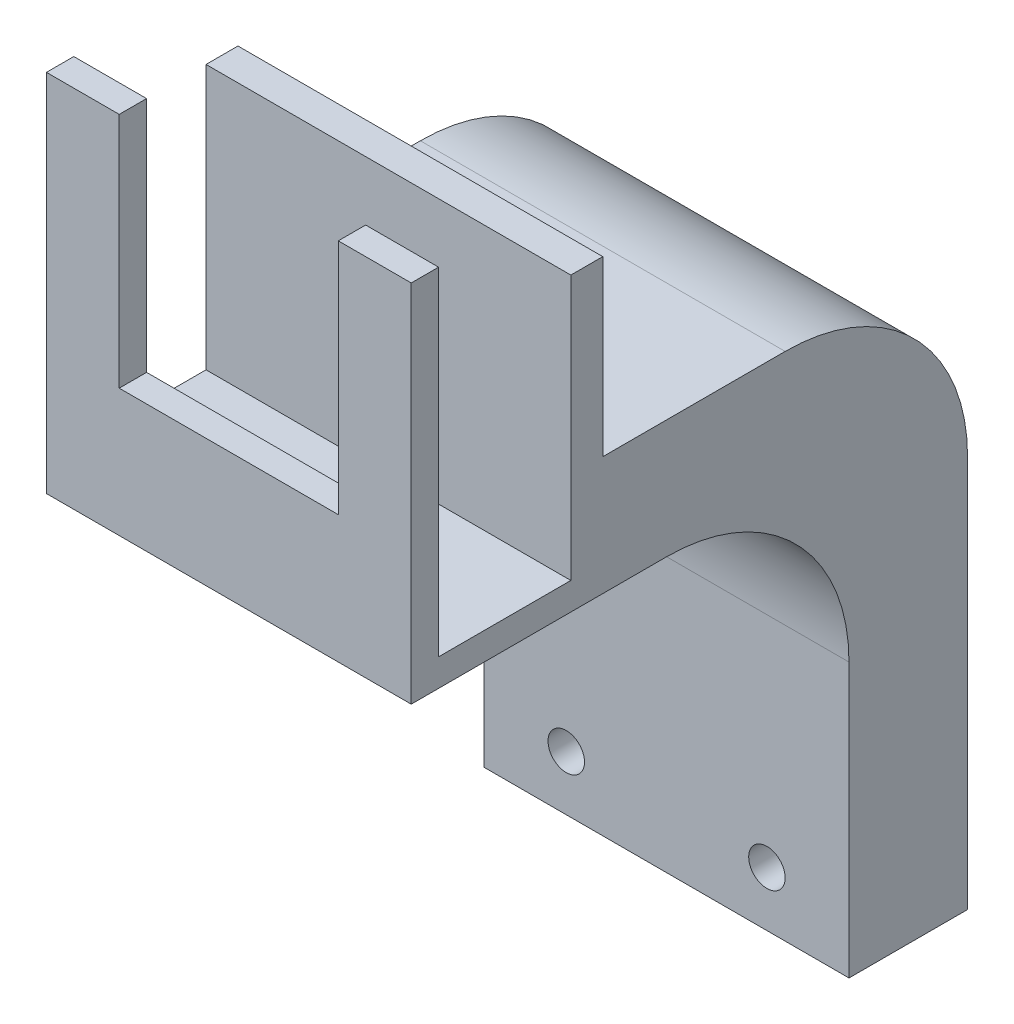
from build123d import *

# Parameters (mm, degrees)
SKETCH_1_W          = 40
SKETCH_1_H          = 40
EXTRUDE_1_DEPTH     = 21
SKETCH_2_W          = 14.5
SKETCH_2_H          = 37
CUT_EXTRUDE_1_DEPTH = 61.340699366
CUT_EXTRUDE_2_REACH = 62.341
SKETCH_3_W          = 24.017804412
SKETCH_3_H          = 26
SKETCH_4_W          = 40
SKETCH_4_H          = 8
CUT_EXTRUDE_3_DEPTH = 16
SKETCH_5_W          = 40
SKETCH_5_H          = 13
EXTRUDE_3_DEPTH     = 40
SKETCH_6_W          = 40
SKETCH_6_H          = 13
EXTRUDE_4_DEPTH     = 50
FILLET_1_R          = 20
FILLET_2_R          = 20
CUT_EXTRUDE_4_REACH = 90.436
SKETCH_7_R          = 2


with BuildPart() as part:
    # 草图1 → 凸台-拉伸1 (new body)
    with BuildSketch(Plane.XY):
        with Locations((20, 20)):
            Rectangle(SKETCH_1_W, SKETCH_1_H)
    extrude(amount=EXTRUDE_1_DEPTH)

    # 草图2 → 切除-拉伸1 (cut, through all)
    with BuildSketch(Plane(origin=(40, 0, 0), x_dir=(0, 0, -1), z_dir=(1, 0, 0))):
        with Locations((-10.75, 21.5)):
            Rectangle(SKETCH_2_W, SKETCH_2_H)
    extrude(amount=-CUT_EXTRUDE_1_DEPTH, mode=Mode.SUBTRACT)

    # 草图3 → 切除-拉伸2 (cut, up to next)
    with BuildSketch(Plane.XY.offset(21), mode=Mode.PRIVATE) as cut_extrude_2_sk1:
        with Locations((19.991097794, 27)):
            Rectangle(SKETCH_3_W, SKETCH_3_H)
    cut_extrude_2_tool1 = extrude(cut_extrude_2_sk1.sketch, amount=-CUT_EXTRUDE_2_REACH, mode=Mode.PRIVATE) & part.part
    add(cut_extrude_2_tool1.solids().sort_by_distance((19.991098, 27, 21))[0], mode=Mode.SUBTRACT)

    # 草图4 → 切除-拉伸3 (cut)
    with BuildSketch(Plane(origin=(0, 0, 0), x_dir=(-1, 0, 0), z_dir=(0, 0, -1))):
        with Locations((-20, 36)):
            Rectangle(SKETCH_4_W, SKETCH_4_H)
    extrude(amount=-CUT_EXTRUDE_3_DEPTH, mode=Mode.SUBTRACT)

    # 草图5 → 凸台-拉伸3 (add)
    with BuildSketch(Plane(origin=(0, 0, 0), x_dir=(-1, 0, 0), z_dir=(0, 0, -1))):
        with Locations((-20, 6.5)):
            Rectangle(SKETCH_5_W, SKETCH_5_H)
    extrude(amount=EXTRUDE_3_DEPTH)

    # 草图6 → 凸台-拉伸4 (add)
    with BuildSketch(Plane.XZ):
        with Locations((20, -33.5)):
            Rectangle(SKETCH_6_W, SKETCH_6_H)
    extrude(amount=EXTRUDE_4_DEPTH)

    # 圆角1
    fillet_1_edges = [part.edges().sort_by_distance(p)[0] for p in [
        (20, 0, -27),
    ]]
    fillet(fillet_1_edges, radius=FILLET_1_R)

    # 圆角2
    fillet_2_edges = [part.edges().sort_by_distance(p)[0] for p in [
        (20, 13, -40),
    ]]
    fillet(fillet_2_edges, radius=FILLET_2_R)

    # 草图7 → 切除-拉伸4 (cut, up to next)
    with BuildSketch(Plane(origin=(0, 0, -40), x_dir=(-1, 0, 0), z_dir=(0, 0, -1)), mode=Mode.PRIVATE) as cut_extrude_4_sk1:
        with Locations((-31, -44)):
            Circle(SKETCH_7_R)
    cut_extrude_4_tool1 = extrude(cut_extrude_4_sk1.sketch, amount=-CUT_EXTRUDE_4_REACH, mode=Mode.PRIVATE) & part.part
    # 草图7 → 切除-拉伸4 (cut, up to next)
    with BuildSketch(Plane(origin=(0, 0, -40), x_dir=(-1, 0, 0), z_dir=(0, 0, -1)), mode=Mode.PRIVATE) as cut_extrude_4_sk2:
        with Locations((-9, -44)):
            Circle(SKETCH_7_R)
    cut_extrude_4_tool2 = extrude(cut_extrude_4_sk2.sketch, amount=-CUT_EXTRUDE_4_REACH, mode=Mode.PRIVATE) & part.part
    add(cut_extrude_4_tool1.solids().sort_by_distance((31, -44, -40))[0], mode=Mode.SUBTRACT)
    add(cut_extrude_4_tool2.solids().sort_by_distance((9, -44, -40))[0], mode=Mode.SUBTRACT)


solid = part.part
